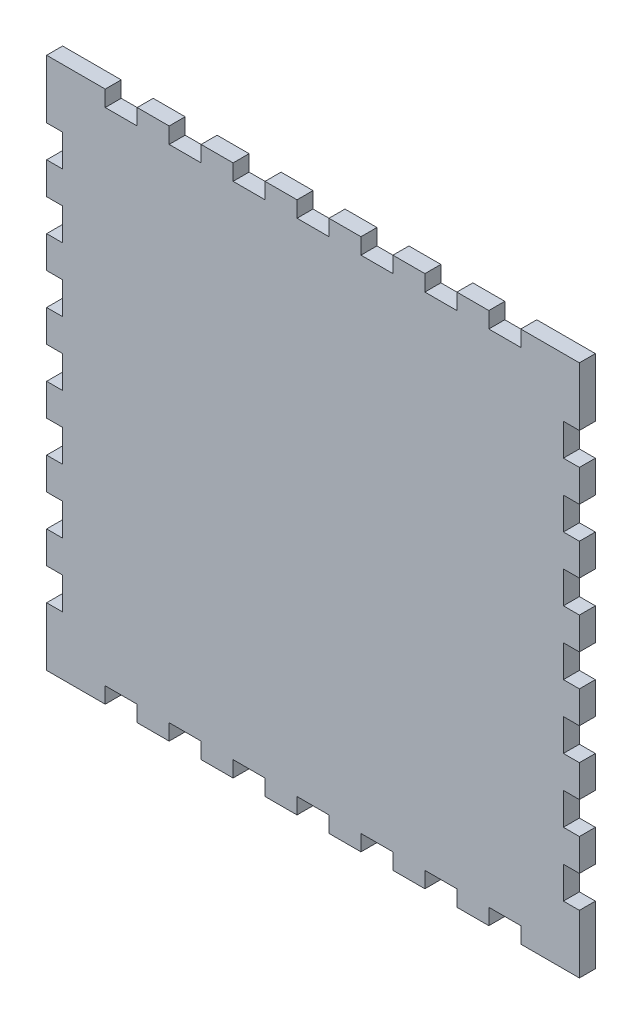
from build123d import *

# Parameters (mm, degrees)
BOSS_EXTRUDE1_DEPTH = 6


with BuildPart() as part:
    # Model → Boss-Extrude1 (new body)
    with BuildSketch(Plane.XY):
        Polygon((0, 203), (0, 181), (6, 181), (6, 169), (0, 169), (0, 157), (6, 157), (6, 145), (0, 145), (0, 133), (6, 133), (6, 121), (0, 121), (0, 109), (6, 109), (6, 97), (0, 97), (0, 85), (6, 85), (6, 73), (0, 73), (0, 61), (6, 61), (6, 49), (0, 49), (0, 37), (6, 37), (6, 25), (0, 25), (0, 13), (0, 3), (22, 3), (22, 9), (34, 9), (34, 3), (46, 3), (46, 9), (58, 9), (58, 3), (70, 3), (70, 9), (82, 9), (82, 3), (94, 3), (94, 9), (106, 9), (106, 3), (118, 3), (118, 9), (130, 9), (130, 3), (142, 3), (142, 9), (154, 9), (154, 3), (166, 3), (166, 9), (178, 9), (178, 3), (190, 3), (200, 3), (200, 25), (194, 25), (194, 37), (200, 37), (200, 49), (194, 49), (194, 61), (200, 61), (200, 73), (194, 73), (194, 85), (200, 85), (200, 97), (194, 97), (194, 109), (200, 109), (200, 121), (194, 121), (194, 133), (200, 133), (200, 145), (194, 145), (194, 157), (200, 157), (200, 169), (194, 169), (194, 181), (200, 181), (200, 193), (200, 203), (178, 203), (178, 197), (166, 197), (166, 203), (154, 203), (154, 197), (142, 197), (142, 203), (130, 203), (130, 197), (118, 197), (118, 203), (106, 203), (106, 197), (94, 197), (94, 203), (82, 203), (82, 197), (70, 197), (70, 203), (58, 203), (58, 197), (46, 197), (46, 203), (34, 203), (34, 197), (22, 197), (22, 203), (10, 203), align=None)
    extrude(amount=BOSS_EXTRUDE1_DEPTH)


solid = part.part
